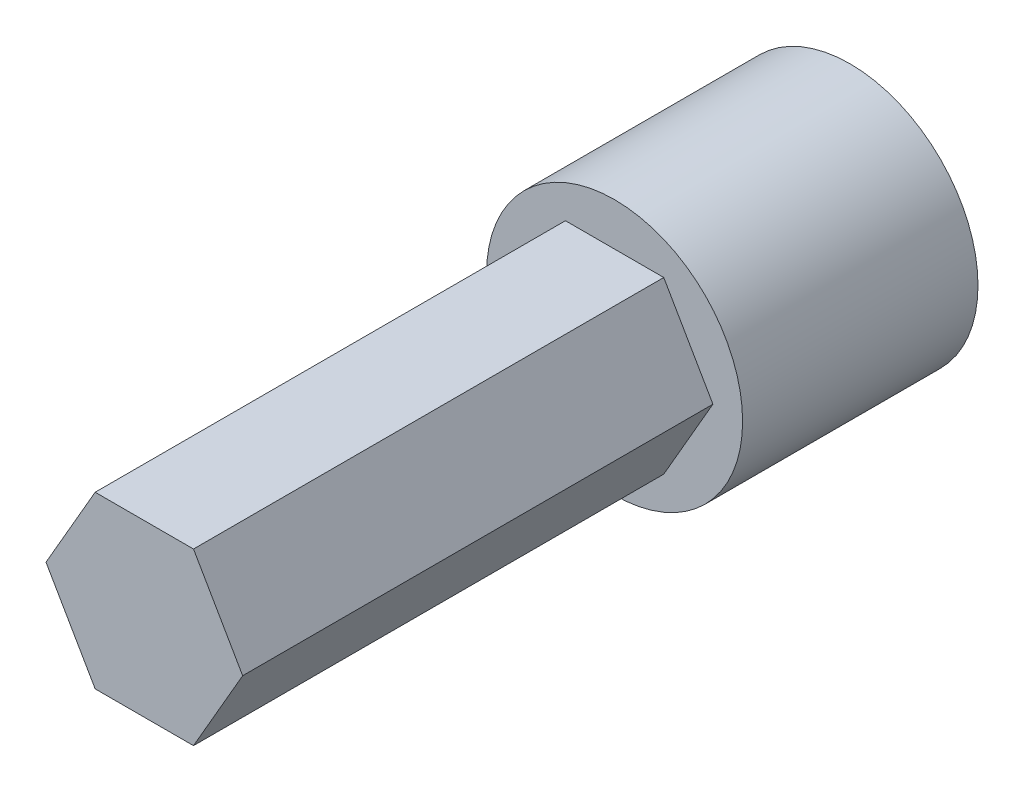
from build123d import *

# Parameters (mm, degrees)
BOSS_EXTRUDE1_DEPTH = 22.0218
SKETCH3_R           = 5.9944
BOSS_EXTRUDE2_DEPTH = 11.0236
SKETCH4_R           = 3.0226
CUT_EXTRUDE1_DEPTH  = 12.5476
SKETCH5_R           = 1.27
CUT_EXTRUDE2_DEPTH  = 6.35


with BuildPart() as part:
    # Sketch1 → Boss-Extrude1 (new body)
    with BuildSketch(Plane.XY):
        Polygon((2.302357403, 3.9878), (-2.302357403, 3.9878), (-4.604714807, 0), (-2.302357403, -3.9878), (2.302357403, -3.9878), (4.604714807, 0), align=None)
    extrude(amount=-BOSS_EXTRUDE1_DEPTH)

    # Sketch3 → Boss-Extrude2 (add)
    with BuildSketch(Plane(origin=(0, 0, -22.0218), x_dir=(-1, 0, 0), z_dir=(0, 0, -1))):
        Circle(SKETCH3_R)
    extrude(amount=BOSS_EXTRUDE2_DEPTH)

    # Sketch4 → Cut-Extrude1 (cut)
    with BuildSketch(Plane(origin=(0, 0, -33.0454), x_dir=(-1, 0, 0), z_dir=(0, 0, -1))):
        Circle(SKETCH4_R)
    extrude(amount=-CUT_EXTRUDE1_DEPTH, mode=Mode.SUBTRACT)

    # Sketch5 → Cut-Extrude2 (cut)
    with BuildSketch(Plane(origin=(-5.19130268, -2.9972, 0), x_dir=(0, 0, 1), z_dir=(-0.8660254037844376, -0.500000000000002, 0))):
        with Locations(Location((-29.2354, 0, 0), (0, 0, 270))):
            Circle(SKETCH5_R)
    extrude(amount=-CUT_EXTRUDE2_DEPTH, mode=Mode.SUBTRACT)


solid = part.part
